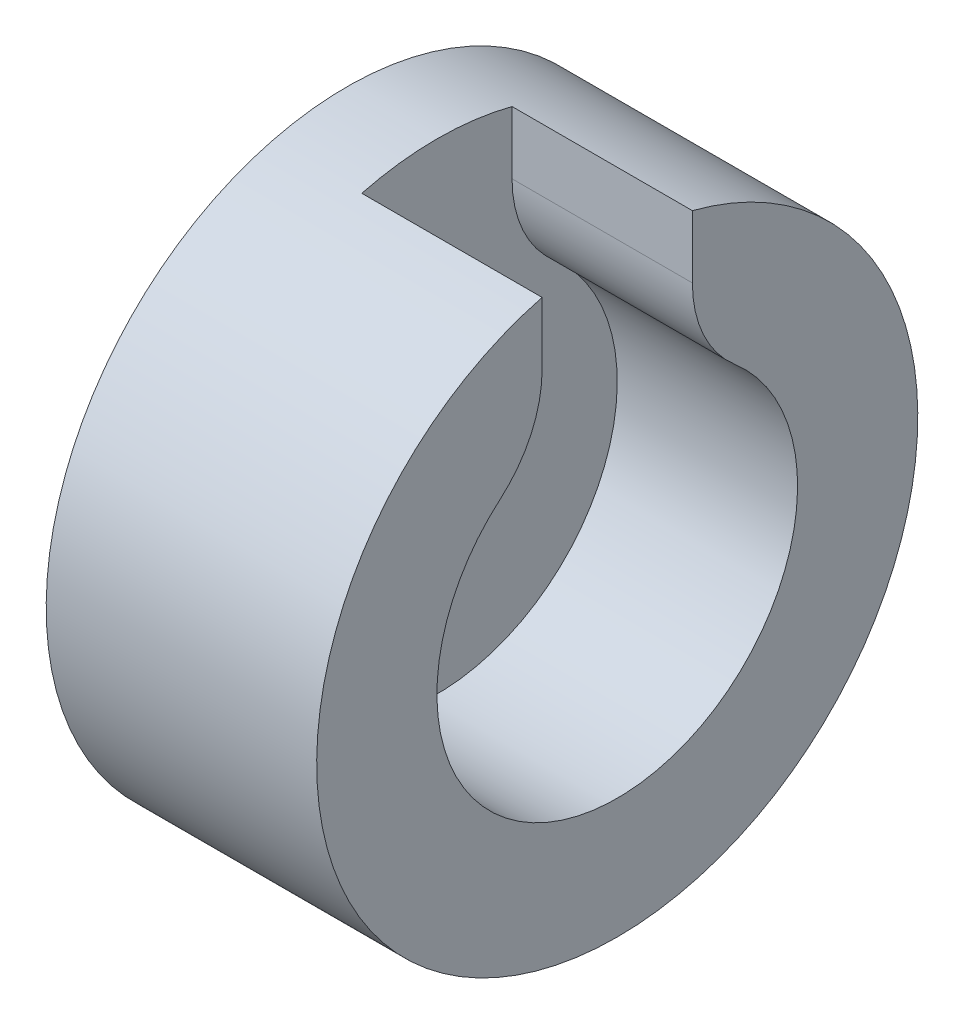
from build123d import *

# Parameters (mm, degrees)
SKETCH1_R           = 5
BOSS_EXTRUDE1_DEPTH = 1.5
SKETCH2_R           = 5
SKETCH2_R_2         = 3
BOSS_EXTRUDE2_DEPTH = 3
CUT_EXTRUDE1_DEPTH  = 8.681145748
FILLET1_R           = 2


with BuildPart() as part:
    # Sketch1 → Boss-Extrude1 (new body)
    with BuildSketch(Plane(origin=(0, 0, 0), x_dir=(0, 0, -1), z_dir=(1, 0, 0))):
        Circle(SKETCH1_R)
    extrude(amount=BOSS_EXTRUDE1_DEPTH)

    # Sketch2 → Boss-Extrude2 (add)
    with BuildSketch(Plane(origin=(1.5, 0, 0), x_dir=(0, 0, -1), z_dir=(1, 0, 0))):
        Circle(SKETCH2_R)
        Circle(SKETCH2_R_2, mode=Mode.SUBTRACT)
    extrude(amount=BOSS_EXTRUDE2_DEPTH)

    # Sketch3 → Cut-Extrude1 (cut, through all)
    with BuildSketch(Plane(origin=(1.5, 0, 0), x_dir=(0, 0, -1), z_dir=(1, 0, 0))):
        with BuildLine():
            Line((-1.25, 6), (-1.25, 2.727178029))
            ThreePointArc((-1.25, 2.727178029), (0, 3), (1.25, 2.727178029))
            Line((1.25, 2.727178029), (1.25, 6))
            Line((1.25, 6), (-1.25, 6))
        make_face()
        with BuildLine():
            Line((-1.25, 2.727178029), (-1.25, 0))
            Line((-1.25, 0), (1.25, 0))
            Line((1.25, 0), (1.25, 2.727178029))
            ThreePointArc((1.25, 2.727178029), (0, 3), (-1.25, 2.727178029))
        make_face()
        with BuildLine():
            Line((1.25, 0), (-1.25, 0))
            Line((-1.25, 0), (-1.25, -2.727178029))
            ThreePointArc((-1.25, -2.727178029), (0, -3), (1.25, -2.727178029))
            Line((1.25, -2.727178029), (1.25, 0))
        make_face()
    extrude(amount=CUT_EXTRUDE1_DEPTH, mode=Mode.SUBTRACT)

    # Fillet1
    fillet1_edges = [part.edges().sort_by_distance(p)[0] for p in [
        (3, 2.727178029, 1.25),
        (3, 2.727178029, -1.25),
    ]]
    fillet(fillet1_edges, radius=FILLET1_R)


solid = part.part
